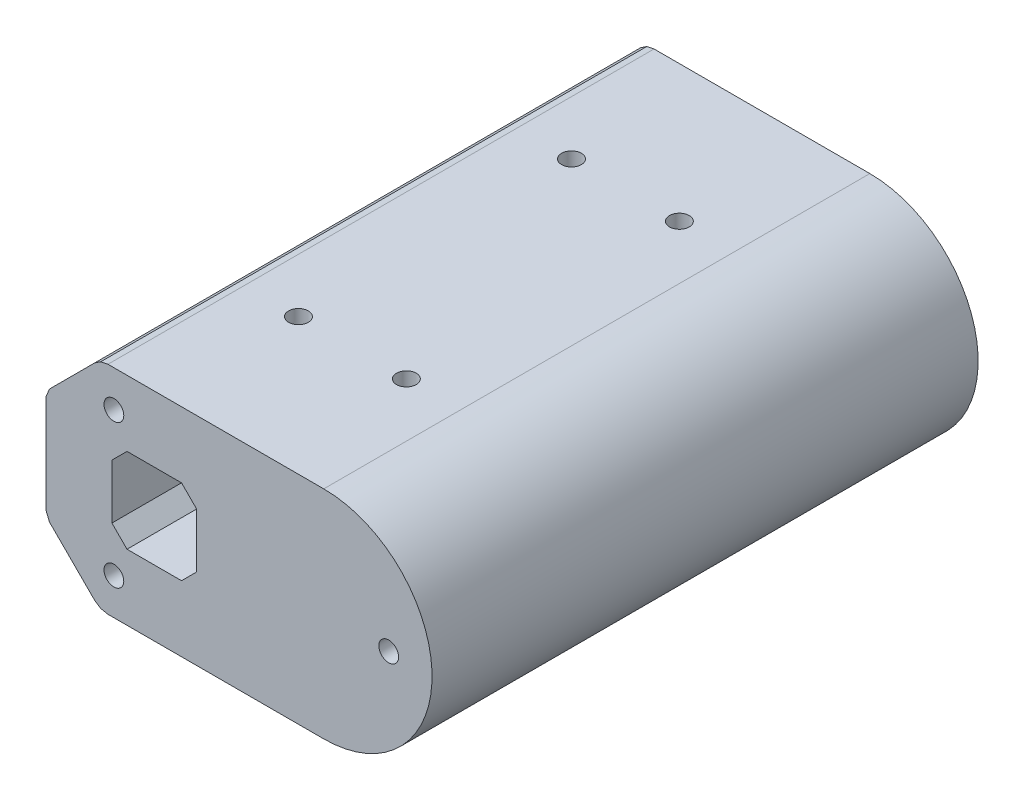
from build123d import *

# Parameters (mm, degrees)
EXTRUDE_1_DEPTH        = 19
CUT_EXTRUDE_1_REACH    = 68.114
EXTRUDE_START          = 97
EXTRUDE_2_DEPTH        = 97
CUT_EXTRUDE_2_REACH    = 134.159
SKETCH_8_R             = 2.1
HOLE_WIZARD_M5_1_D     = 4.2
HOLE_WIZARD_M5_1_DEPTH = 3
HOLE_WIZARD_M5_2_D     = 4.2


with BuildPart() as part:
    # 草图2 → 凸台-拉伸1 (new body)
    with BuildSketch(Plane.XY.offset(-72.500175037)):
        with BuildLine():
            Line((-9.84018, -23), (-11.373653726, -22.694973111))
            Line((-11.373653726, -22.694973111), (-12.673669978, -21.826330022))
            Line((-12.673669978, -21.826330022), (-22.257871236, -12.242128764))
            Line((-22.257871236, -12.242128764), (-23, -10.450471437))
            Line((-23, -10.450471437), (-23, 10.450471437))
            Line((-23, 10.450471437), (-22.257871236, 12.242128764))
            Line((-22.257871236, 12.242128764), (-12.673669978, 21.826330022))
            Line((-12.673669978, 21.826330022), (-11.373653726, 22.694973111))
            Line((-11.373653726, 22.694973111), (-9.84018, 23))
            Line((-9.84018, 23), (36.000000003, 23))
            ThreePointArc((36.000000003, 23), (59.000000003, 0), (36.000000003, -23))
            Line((36.000000003, -23), (-9.84018, -23))
        make_face()
    extrude(amount=EXTRUDE_1_DEPTH)

    # 草图4 → 切除-拉伸1 (cut, up to next)
    with BuildSketch(Plane.XY.offset(-53.500175037), mode=Mode.PRIVATE) as cut_extrude_1_sk1:
        Polygon((5.790000003, -9), (-5.789999997, -9), (-8.999999997, -5.79), (-8.999999997, 5.79), (-5.789999997, 9), (5.790000003, 9), (9.000000003, 5.79), (9.000000003, -5.79), align=None)
    cut_extrude_1_tool1 = extrude(cut_extrude_1_sk1.sketch, amount=-CUT_EXTRUDE_1_REACH, mode=Mode.PRIVATE) & part.part
    add(cut_extrude_1_tool1.solids().sort_by_distance((0, 0, -53.500175))[0], mode=Mode.SUBTRACT)

    # 草图7 → 凸台-拉伸2 (add)
    with BuildSketch(Plane(origin=(0, 0, -72.500175037), x_dir=(-1, 0, 0), z_dir=(0, 0, -1)).offset(EXTRUDE_START)):
        with BuildLine():
            Line((-36.000000003, 23), (9.84018, 23))
            Line((9.84018, 23), (11.373653726, 22.694973111))
            Line((11.373653726, 22.694973111), (12.673669978, 21.826330022))
            Line((12.673669978, 21.826330022), (22.257871236, 12.242128764))
            Line((22.257871236, 12.242128764), (22.628935618, 11.3463001))
            Line((22.628935618, 11.3463001), (23, 10.450471437))
            Line((23, 10.450471437), (23, -10.450471437))
            Line((23, -10.450471437), (22.628935618, -11.3463001))
            Line((22.628935618, -11.3463001), (22.257871236, -12.242128764))
            Line((22.257871236, -12.242128764), (12.673669978, -21.826330022))
            Line((12.673669978, -21.826330022), (11.373653726, -22.694973111))
            Line((11.373653726, -22.694973111), (9.84018, -23))
            Line((9.84018, -23), (-36.000000003, -23))
            ThreePointArc((-36.000000003, -23), (-59, 0), (-36.000000003, 23))
        make_face()
        with BuildLine():
            Line((3.252486509, 20), (8.556678261, 20))
            ThreePointArc((8.556678261, 20), (9.890133674, 19.734759227), (11.020582589, 18.979417411))
            Line((11.020582589, 18.979417411), (19.35467064, 10.64532936))
            ThreePointArc((19.35467064, 10.64532936), (19.832284364, 9.930529909), (20, 9.087366467))
            Line((20, 9.087366467), (20, -9.087366467))
            ThreePointArc((20, -9.087366467), (19.832284364, -9.930529909), (19.35467064, -10.64532936))
            Line((19.35467064, -10.64532936), (11.020582589, -18.979417411))
            ThreePointArc((11.020582589, -18.979417411), (9.890133674, -19.734759227), (8.556678261, -20))
            Line((8.556678261, -20), (-36, -20))
            ThreePointArc((-36, -20), (-56, 0), (-36, 20))
            Line((-36, 20), (3.252486509, 20))
        make_face(mode=Mode.SUBTRACT)
    extrude(amount=-EXTRUDE_2_DEPTH)

    # 草图8 → 切除-拉伸2 (cut, up to next)
    with BuildSketch(Plane.XY.offset(-53.500175037), mode=Mode.PRIVATE) as cut_extrude_2_sk1:
        with Locations((49.800000003, 0)):
            Circle(SKETCH_8_R)
    cut_extrude_2_tool1 = extrude(cut_extrude_2_sk1.sketch, amount=-CUT_EXTRUDE_2_REACH, mode=Mode.PRIVATE) & part.part
    # 草图8 → 切除-拉伸2 (cut, up to next)
    with BuildSketch(Plane.XY.offset(-53.500175037), mode=Mode.PRIVATE) as cut_extrude_2_sk2:
        with Locations((-8.579999997, -15.24)):
            Circle(SKETCH_8_R)
    cut_extrude_2_tool2 = extrude(cut_extrude_2_sk2.sketch, amount=-CUT_EXTRUDE_2_REACH, mode=Mode.PRIVATE) & part.part
    # 草图8 → 切除-拉伸2 (cut, up to next)
    with BuildSketch(Plane.XY.offset(-53.500175037), mode=Mode.PRIVATE) as cut_extrude_2_sk3:
        with Locations((-8.579999997, 15.24)):
            Circle(SKETCH_8_R)
    cut_extrude_2_tool3 = extrude(cut_extrude_2_sk3.sketch, amount=-CUT_EXTRUDE_2_REACH, mode=Mode.PRIVATE) & part.part
    add(cut_extrude_2_tool1.solids().sort_by_distance((49.8, 0, -53.500175))[0], mode=Mode.SUBTRACT)
    add(cut_extrude_2_tool2.solids().sort_by_distance((-8.58, -15.24, -53.500175))[0], mode=Mode.SUBTRACT)
    add(cut_extrude_2_tool3.solids().sort_by_distance((-8.58, 15.24, -53.500175))[0], mode=Mode.SUBTRACT)

    # M5 螺纹孔1
    with Locations(Plane(origin=(0, -23, 0), x_dir=(-1, 0, 0), z_dir=(0, -1, 0))):
        with Locations((-1.619865001, 82.500175037), (-24.539955002, 82.500175037), (-24.539955002, 140.500175037), (-1.619865001, 140.500175037)):
            Hole(HOLE_WIZARD_M5_1_D / 2, depth=HOLE_WIZARD_M5_1_DEPTH)

    # M5 螺纹孔2 (through all)
    with Locations(Plane(origin=(0, 23, 0), x_dir=(1, 0, 0), z_dir=(0, 1, 0))):
        with Locations((24.539955002, 140.500175037), (1.619865001, 140.500175037), (24.539955002, 82.500175037), (1.619865001, 82.500175037)):
            Hole(HOLE_WIZARD_M5_2_D / 2)


solid = part.part
